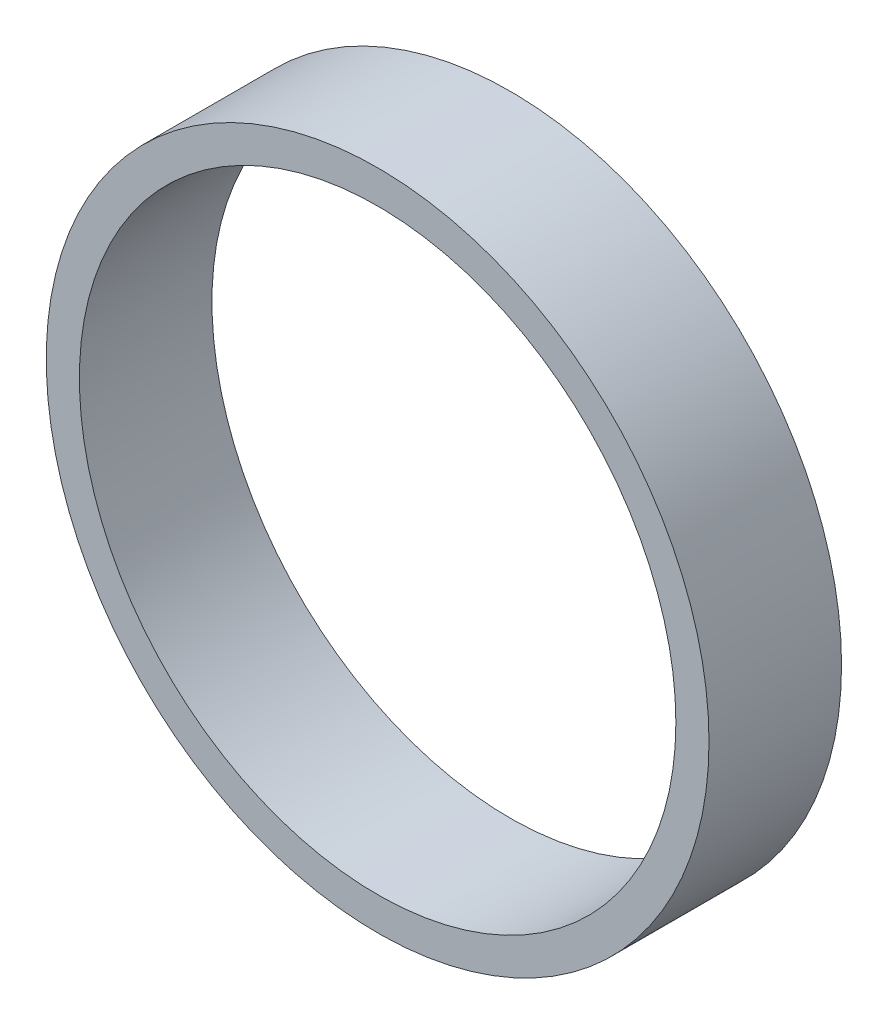
from build123d import *

# Parameters (mm, degrees)
SKETCH1_R           = 31.75
SKETCH1_R_2         = 28.575
BOSS_EXTRUDE1_DEPTH = 12.7


with BuildPart() as part:
    # Sketch1 → Boss-Extrude1 (new body)
    with BuildSketch(Plane.XY):
        Circle(SKETCH1_R)
        Circle(SKETCH1_R_2, mode=Mode.SUBTRACT)
    extrude(amount=BOSS_EXTRUDE1_DEPTH)


solid = part.part
